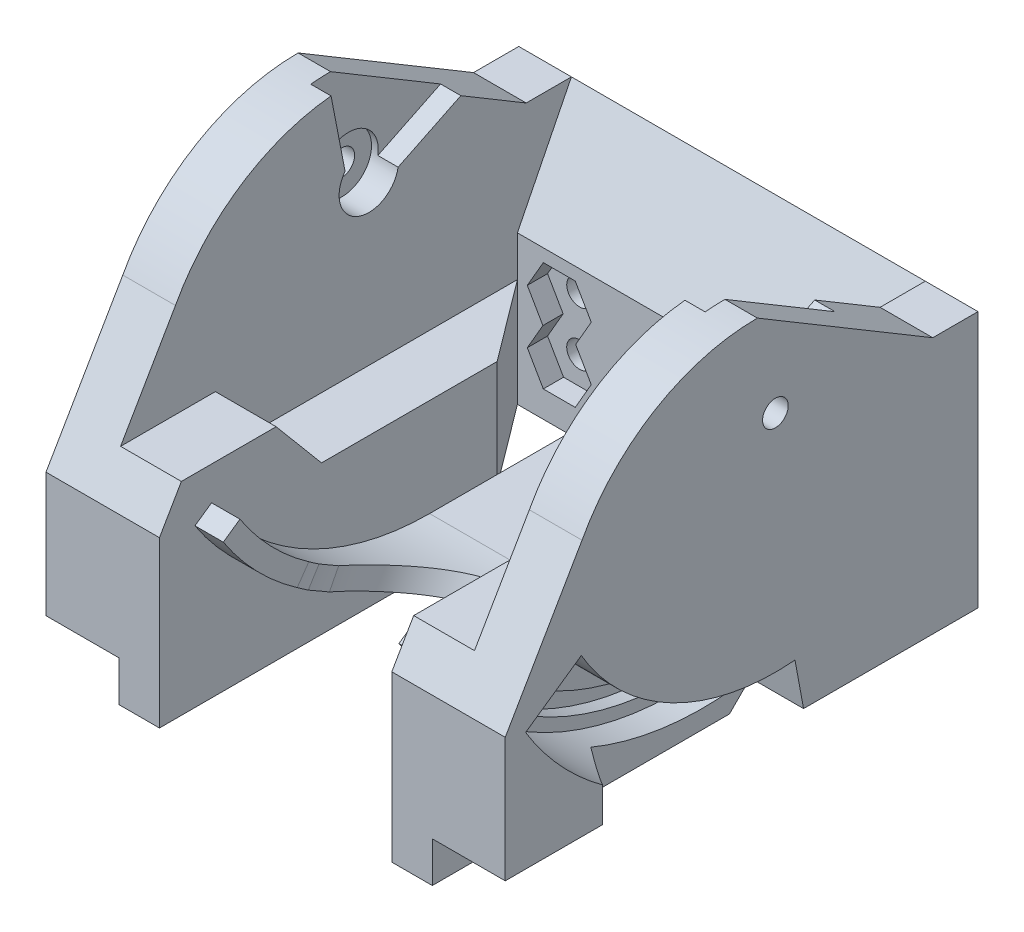
from build123d import *

# Parameters (mm, degrees)
CROQUIS1_W               = 34
CROQUIS1_H               = 19
SALIENTE_EXTRUIR1_DEPTH  = 35
CROQUIS2_W               = 26.2
CROQUIS2_H               = 31
CORTAR_EXTRUIR1_DEPTH    = 25
CORTAR_EXTRUIR3_DEPTH    = 26.2
SALIENTE_EXTRUIR2_DEPTH  = 34
CROQUIS10_W              = 26.2
CROQUIS10_H              = 25.966324345
CORTAR_EXTRUIR4_DEPTH    = 10
CROQUIS18_R              = 0.95
CORTAR_EXTRUIR11_DEPTH   = 4
CORTAR_EXTRUIR12_DEPTH   = 1.5
CORTAR_EXTRUIR14_START   = -34
CROQUIS21_R              = 0.95
CORTAR_EXTRUIR14_DEPTH   = 34
SALIENTE_EXTRUIR3_DEPTH  = 8
CROQUIS25_W              = 3
CROQUIS25_H              = 25
SALIENTE_EXTRUIR4_DEPTH  = 3
CROQUIS43_W              = 4.5
CROQUIS43_H              = 12
SALIENTE_EXTRUIR8_DEPTH  = 4
CORTAR_EXTRUIR18_DEPTH   = 7.4
CORTAR_EXTRUIR16_START   = -34
CORTAR_EXTRUIR16_DEPTH   = 26.6
CORTAR_EXTRUIR20_START   = -1.5
CORTAR_EXTRUIR20_DEPTH   = 1.5
CORTAR_EXTRUIR21_DEPTH   = 27.7
CORTAR_EXTRUIR22_START   = -34
CORTAR_EXTRUIR22_DEPTH   = 34
CORTAR_EXTRUIR23_DEPTH   = 3
CROQUIS36_R              = 2.2
CORTAR_EXTRUIR24_DEPTH   = 2
CORTAR_EXTRUIR25_START   = 28.2
CROQUIS36_2_R            = 2.2
CORTAR_EXTRUIR25_DEPTH   = 28.2
CORTAR_EXTRUIR26_START   = -34
CORTAR_EXTRUIR26_DEPTH   = 34
CORTAR_EXTRUIR27_DEPTH   = 1
CORTAR_EXTRUIR28_START   = -23.2
CORTAR_EXTRUIR28_DEPTH   = 23.2
CORTAR_EXTRUIR29_DEPTH   = 26.2
SALIENTE_EXTRUIR9_DEPTH  = 17.2
CROQUIS49_R              = 6.5
CROQUIS50_R              = 6.5
CROQUIS53_W              = 17.2
CROQUIS53_H              = 1.49981493
SALIENTE_EXTRUIR13_DEPTH = 11
SALIENTE_EXTRUIR14_DEPTH = 17.2


with BuildPart() as part:
    # Croquis1 → Saliente-Extruir1 (new body)
    with BuildSketch(Plane.XY):
        with Locations((-31.887263086, 5.12254902)):
            Rectangle(CROQUIS1_W, CROQUIS1_H)
    extrude(amount=SALIENTE_EXTRUIR1_DEPTH)

    # Croquis2 → Cortar-Extruir1 (cut)
    with BuildSketch(Plane.XZ.offset(4.37745098)):
        with Locations((-31.887263086, 19.5)):
            Rectangle(CROQUIS2_W, CROQUIS2_H)
    extrude(amount=-CORTAR_EXTRUIR1_DEPTH, mode=Mode.SUBTRACT)

    # Croquis4 → Cortar-Extruir3 (cut)
    with BuildSketch(Plane.ZY.offset(18.787263086)):
        Polygon((4, 14.62254902), (4, 6.62254902), (0, 14.62254902), align=None)
    extrude(amount=CORTAR_EXTRUIR3_DEPTH, mode=Mode.SUBTRACT)

    # Croquis9 → Saliente-Extruir2 (add)
    with BuildSketch(Plane(origin=(-14.887263086, 0, 0), x_dir=(0, 0, -1), z_dir=(1, 0, 0))):
        with BuildLine():
            Line((-29.315831827, 14.62254902), (-3.349507482, 14.62254902))
            ThreePointArc((-3.349507482, 14.62254902), (-16.332669655, 22.37254902), (-29.315831827, 14.62254902))
        make_face()
    extrude(amount=-SALIENTE_EXTRUIR2_DEPTH)

    # Croquis10 → Cortar-Extruir4 (cut)
    with BuildSketch(Plane.XZ.offset(-14.62254902)):
        with Locations((-31.887263086, 16.332669655)):
            Rectangle(CROQUIS10_W, CROQUIS10_H)
    extrude(amount=-CORTAR_EXTRUIR4_DEPTH, mode=Mode.SUBTRACT)

    # Croquis18 → Cortar-Extruir11 (cut)
    with BuildSketch(Plane(origin=(0, 0, 0), x_dir=(-1, 0, 0), z_dir=(0, 0, -1))):
        with Locations((41.887263086, -0.37745098)):
            Circle(CROQUIS18_R)
        with Locations((21.887263086, -0.37745098)):
            Circle(CROQUIS18_R)
        with Locations((21.887263086, 3.62254902)):
            Circle(CROQUIS18_R)
        with Locations((41.887263086, 3.62254902)):
            Circle(CROQUIS18_R)
    extrude(amount=-CORTAR_EXTRUIR11_DEPTH, mode=Mode.SUBTRACT)

    # Croquis19 → Cortar-Extruir12 (cut)
    with BuildSketch(Plane.XY.offset(4)):
        Polygon((-39.520126982, -0.37745098), (-40.67482752, 1.62254902), (-39.520126982, 3.62254902), (-40.703695034, 5.67254902), (-43.070831137, 5.67254902), (-44.254399189, 3.62254902), (-43.099698651, 1.62254902), (-44.254399189, -0.37745098), (-43.070831137, -2.42745098), (-40.703695034, -2.42745098), align=None)
        Polygon((-19.520126982, -0.37745098), (-20.67482752, 1.62254902), (-19.520126982, 3.62254902), (-20.703695034, 5.67254902), (-23.070831137, 5.67254902), (-24.254399189, 3.62254902), (-23.099698651, 1.62254902), (-24.254399189, -0.37745098), (-23.070831137, -2.42745098), (-20.703695034, -2.42745098), align=None)
    extrude(amount=-CORTAR_EXTRUIR12_DEPTH, mode=Mode.SUBTRACT)

    # Croquis21 → Cortar-Extruir14 (cut)
    with BuildSketch(Plane(origin=(-14.887263086, 0, 0), x_dir=(0, 0, -1), z_dir=(1, 0, 0)).offset(CORTAR_EXTRUIR14_START)):
        with Locations((-15, 15.62254902)):
            Circle(CROQUIS21_R)
    extrude(amount=CORTAR_EXTRUIR14_DEPTH, mode=Mode.SUBTRACT)

    # Croquis23 → Saliente-Extruir3 (add)
    with BuildSketch(Plane.XZ.offset(4.37745098)):
        Polygon((-44.987263086, 35), (-40.487263086, 35), (-40.487263086, 10), (-44.987263086, 4), align=None)
        Polygon((-18.787263086, 35), (-23.287263086, 35), (-23.287263086, 10), (-18.787263086, 4), align=None)
    extrude(amount=-SALIENTE_EXTRUIR3_DEPTH)

    # Croquis25 → Saliente-Extruir4 (add)
    with BuildSketch(Plane.XZ.offset(4.37745098)):
        with Locations((-41.987263086, 22.5)):
            Rectangle(CROQUIS25_W, CROQUIS25_H)
        with Locations((-21.787263086, 22.5)):
            Rectangle(CROQUIS25_W, CROQUIS25_H)
    extrude(amount=SALIENTE_EXTRUIR4_DEPTH)

    # Croquis43 → Saliente-Extruir8 (add)
    with BuildSketch(Plane(origin=(0, 3.62254902, 0), x_dir=(1, 0, 0), z_dir=(0, 1, 0))):
        with Locations((-21.037263086, -29)):
            Rectangle(CROQUIS43_W, CROQUIS43_H)
        with Locations((-42.737263086, -29)):
            Rectangle(CROQUIS43_W, CROQUIS43_H)
    extrude(amount=SALIENTE_EXTRUIR8_DEPTH)

    # Croquis27 → Cortar-Extruir18 (cut)
    with BuildSketch(Plane(origin=(-14.887263086, 0, 0), x_dir=(0, 0, -1), z_dir=(1, 0, 0))):
        with BuildLine():
            Line((-13.549434023, -0.942577786), (-12.635457129, -5.887329478))
            ThreePointArc((-12.635457129, -5.887329478), (-24.560215782, -3.790544761), (-33.492032026, 4.383746258))
            Line((-33.492032026, 4.383746258), (-29.371216121, 7.25740019))
            ThreePointArc((-29.371216121, 7.25740019), (-22.651516826, 0.859017666), (-13.549434023, -0.942577786))
        make_face()
    extrude(amount=-CORTAR_EXTRUIR18_DEPTH, mode=Mode.SUBTRACT)

    # Croquis24 → Cortar-Extruir16 (cut)
    with BuildSketch(Plane(origin=(-14.887263086, 0, 0), x_dir=(0, 0, -1), z_dir=(1, 0, 0)).offset(CORTAR_EXTRUIR16_START)):
        with BuildLine():
            Line((-15, -3.62745098), (-15, -5.12726591))
            ThreePointArc((-15, -5.12726591), (-24.876851848, -2.625810281), (-32.372332418, 4.275439874))
            Line((-32.372332418, 4.275439874), (-31.142668885, 5.135569413))
            ThreePointArc((-31.142668885, 5.135569413), (-24.183902835, -1.295442254), (-15, -3.62745098))
        make_face()
    extrude(amount=CORTAR_EXTRUIR16_DEPTH, mode=Mode.SUBTRACT)

    # Croquis29 → Cortar-Extruir20 (cut)
    with BuildSketch(Plane.ZY.offset(18.787263086).offset(CORTAR_EXTRUIR20_START)):
        with BuildLine():
            Line((17.797402962, 22.299641931), (16.5, 15.62254902))
            ThreePointArc((16.5, 15.62254902), (15.426958984, 14.184596995), (13.743058632, 14.803953638))
            Line((13.743058632, 14.803953638), (6.296886003, 18.432060872))
            ThreePointArc((6.296886003, 18.432060872), (11.631045274, 21.603150873), (17.797402962, 22.299641931))
        make_face()
    extrude(amount=CORTAR_EXTRUIR20_DEPTH, mode=Mode.SUBTRACT)

    # Croquis29<2> → Cortar-Extruir21 (cut)
    with BuildSketch(Plane.ZY.offset(18.787263086)):
        with BuildLine():
            Line((17.797402962, 22.299641931), (16.5, 15.62254902))
            ThreePointArc((16.5, 15.62254902), (15.426958984, 14.184596995), (13.743058632, 14.803953638))
            Line((13.743058632, 14.803953638), (6.296886003, 18.432060872))
            ThreePointArc((6.296886003, 18.432060872), (11.631045274, 21.603150873), (17.797402962, 22.299641931))
        make_face()
    extrude(amount=CORTAR_EXTRUIR21_DEPTH, mode=Mode.SUBTRACT)

    # Croquis30 → Cortar-Extruir22 (cut)
    with BuildSketch(Plane.ZY.offset(48.887263086).offset(CORTAR_EXTRUIR22_START)):
        Polygon((29.315831827, 14.62254902), (35, 4.827802707), (35, 14.62254902), align=None)
    extrude(amount=CORTAR_EXTRUIR22_DEPTH, mode=Mode.SUBTRACT)

    # Croquis35 → Cortar-Extruir23 (cut)
    with BuildSketch(Plane.XZ.offset(4.37745098)):
        Polygon((-20.287263086, 23.262320252), (-14.887263086, 23.262320252), (-14.887263086, 27.796275801), align=None)
    extrude(amount=-CORTAR_EXTRUIR23_DEPTH, mode=Mode.SUBTRACT)

    # Croquis36 → Cortar-Extruir24 (cut)
    with BuildSketch(Plane.ZY.offset(18.787263086)):
        with Locations((15, 15.62254902)):
            Circle(CROQUIS36_R)
    extrude(amount=-CORTAR_EXTRUIR24_DEPTH, mode=Mode.SUBTRACT)

    # Croquis36<2> → Cortar-Extruir25 (cut)
    with BuildSketch(Plane.ZY.offset(18.787263086).offset(CORTAR_EXTRUIR25_START)):
        with Locations((15, 15.62254902)):
            Circle(CROQUIS36_2_R)
    extrude(amount=-CORTAR_EXTRUIR25_DEPTH, mode=Mode.SUBTRACT)

    # Croquis38 → Cortar-Extruir26 (cut)
    with BuildSketch(Plane.ZY.offset(48.887263086).offset(CORTAR_EXTRUIR26_START)):
        Polygon((3.349507482, 14.62254902), (16.332669655, 22.37254902), (3.349507482, 22.37254902), align=None)
    extrude(amount=CORTAR_EXTRUIR26_DEPTH, mode=Mode.SUBTRACT)

    # Croquis40 → Cortar-Extruir27 (cut)
    with BuildSketch(Plane.ZY.offset(48.887263086)):
        Polygon((24.462469518, 4.967906508), (27.804965088, 0.984475403), (27.192129534, 0.470245316), (23.849633963, 4.45367642), align=None)
        Polygon((23.499956861, 4.180731289), (26.48255433, -0.078859342), (25.827232695, -0.537720491), (22.844635226, 3.72187014), align=None)
        Polygon((22.469633136, 3.484764914), (25.069633136, -1.018567186), (24.376812813, -1.418567186), (21.776812813, 3.084764914), align=None)
        Polygon((21.381853505, 2.883100647), (23.579468466, -1.829699846), (22.854422236, -2.167794455), (20.656807275, 2.545006037), align=None)
    extrude(amount=-CORTAR_EXTRUIR27_DEPTH, mode=Mode.SUBTRACT)

    # Croquis41 → Cortar-Extruir28 (cut)
    with BuildSketch(Plane(origin=(-20.287263086, 0, 0), x_dir=(0, 0, -1), z_dir=(1, 0, 0)).offset(CORTAR_EXTRUIR28_START)):
        Polygon((-10, -4.37745098), (-10, -7.37745098), (-13, -7.37745098), align=None)
    extrude(amount=CORTAR_EXTRUIR28_DEPTH, mode=Mode.SUBTRACT)

    # Croquis44 → Cortar-Extruir29 (cut)
    with BuildSketch(Plane.ZY.offset(18.787263086)):
        Polygon((23, 7.62254902), (26.362551066, 7.62254902), (23, 3.62254902), align=None)
    extrude(amount=CORTAR_EXTRUIR29_DEPTH, mode=Mode.SUBTRACT)



with BuildPart() as body_2:
    # Croquis45 → Saliente-Extruir9 (new body)
    with BuildSketch(Plane.ZY.offset(23.287263086)):
        with BuildLine():
            Line((31.142668885, 5.135569413), (32.372332418, 4.275439874))
            ThreePointArc((32.372332418, 4.275439874), (24.876851848, -2.625810281), (15, -5.12726591))
            Line((15, -5.12726591), (15, -3.62745098))
            ThreePointArc((15, -3.62745098), (24.183902835, -1.295442254), (31.142668885, 5.135569413))
        make_face()
    extrude(amount=SALIENTE_EXTRUIR9_DEPTH)

    # Cortar-Barrer2: sweep along a path in Croquis47
    with BuildLine(Plane(origin=(-31.887263086, 4.275439874, 32.372332418), x_dir=(0, 0, -1), z_dir=(1, 0, 0))) as cortar_barrer2_path:
        Line((17.372332418, 11.347109145), (-5.570725036, -21.418972626))
    # Croquis48 → Cortar-Barrer2 (sweep, cut)
    with BuildSketch(Plane(origin=(-31.887263086, -17.143532752, 37.943057454), x_dir=(-1, 0, 0), z_dir=(0, -0.8191520442889911, 0.5735764363510472))):
        with BuildLine():
            Line((6.5, 0), (6.5, -15))
            Line((6.5, -15), (-6.5, -15))
            Line((-6.5, -15), (-6.5, 0))
            ThreePointArc((-6.5, 0), (0, 6.5), (6.5, 0))
        make_face()
    sweep(path=cortar_barrer2_path.line, mode=Mode.SUBTRACT)

    # Cortar-Barrer3: sweep along a path in Croquis51
    with BuildLine(Plane(origin=(-31.887263086, 4.275439874, 32.372332418), x_dir=(0, 0, -1), z_dir=(1, 0, 0))) as cortar_barrer3_path:
        Line((17.372332418, 11.347109145), (-2.627667582, -23.293907006))
    # Croquis49 → Cortar-Barrer3 (sweep, cut)
    with BuildSketch(Plane(origin=(-31.887263086, -19.018467132, 35), x_dir=(-1, 0, 0), z_dir=(0, -0.8660254037844382, 0.5000000000000011))):
        Circle(CROQUIS49_R)
    sweep(path=cortar_barrer3_path.line, mode=Mode.SUBTRACT)

    # Cortar-Barrer4: sweep along a path in Croquis52
    with BuildLine(Plane(origin=(-31.887263086, 4.275439874, 32.372332418), x_dir=(0, 0, -1), z_dir=(1, 0, 0))) as cortar_barrer4_path:
        Line((17.372332418, 11.347109145), (0.467601948, -24.905202336))
    # Croquis50 → Cortar-Barrer4 (sweep, cut)
    with BuildSketch(Plane(origin=(-31.887263086, -20.629762462, 31.90473047), x_dir=(-1, 0, 0), z_dir=(0, -0.9063077870366495, 0.4226182617407004))):
        Circle(CROQUIS50_R)
    sweep(path=cortar_barrer4_path.line, mode=Mode.SUBTRACT)


with BuildPart() as body_3:
    # Croquis53 → Saliente-Extruir13 (new body)
    with BuildSketch(Plane(origin=(0, 0, 15), x_dir=(-1, 0, 0), z_dir=(0, 0, -1))):
        with Locations((31.887263086, -4.377358445)):
            Rectangle(CROQUIS53_W, CROQUIS53_H)
    extrude(amount=SALIENTE_EXTRUIR13_DEPTH)


with BuildPart() as part_1:
    add(part.part)

    add(body_3.part)  # Saliente-Extruir14 merges body 3
    # Croquis55 → Saliente-Extruir14 (add)
    with BuildSketch(Plane.ZY.offset(40.487263086)):
        Polygon((4, -5.12726591), (4, -4.377358445), (0, -4.377358445), align=None)
    extrude(amount=-SALIENTE_EXTRUIR14_DEPTH)


solid = Compound([body_2.part, part_1.part])
